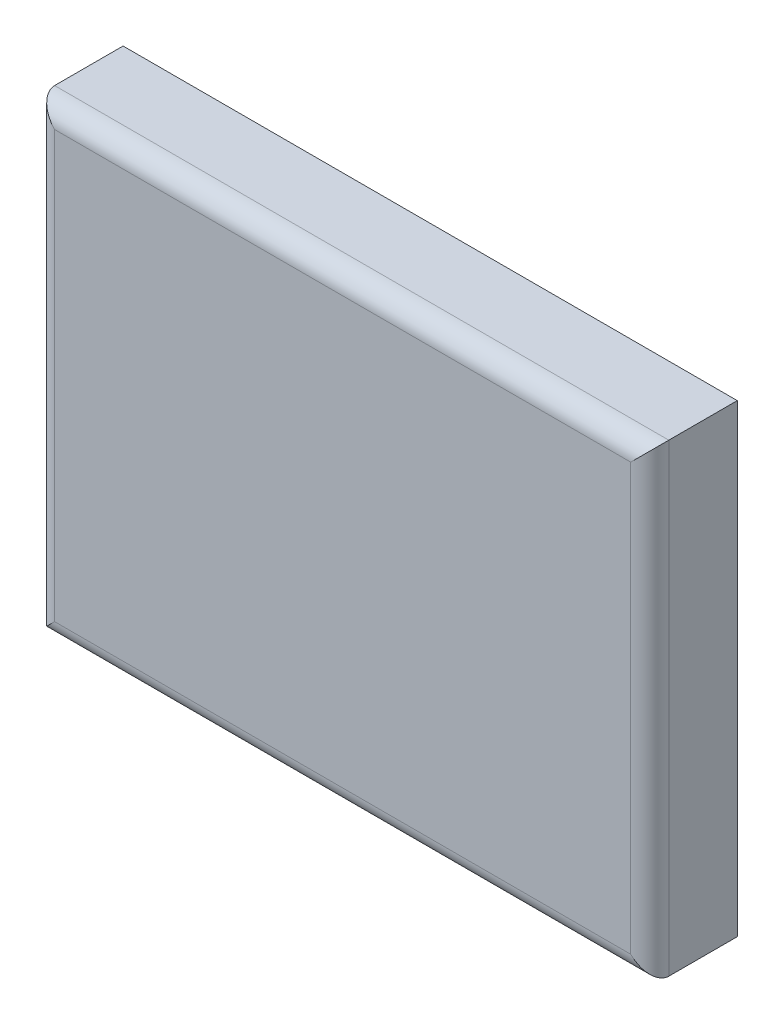
from build123d import *

# Parameters (mm, degrees)
SKETCH_1_W      = 16.14
SKETCH_1_H      = 12.2
EXTRUDE_1_DEPTH = 2.3
FILLET_1_R      = 0.5


with BuildPart() as part:
    # Эскиз1 → Бобышка-Вытянуть1 (new body)
    with BuildSketch(Plane.XY):
        Rectangle(SKETCH_1_W, SKETCH_1_H)
    extrude(amount=EXTRUDE_1_DEPTH)

    # Скругление1
    fillet_1_edges = [part.edges().sort_by_distance(p)[0] for p in [
        (-8.07, 0, 2.3),
        (0, -6.1, 2.3),
        (8.07, 0, 2.3),
        (0, 6.1, 2.3),
    ]]
    fillet(fillet_1_edges, radius=FILLET_1_R)


solid = part.part
